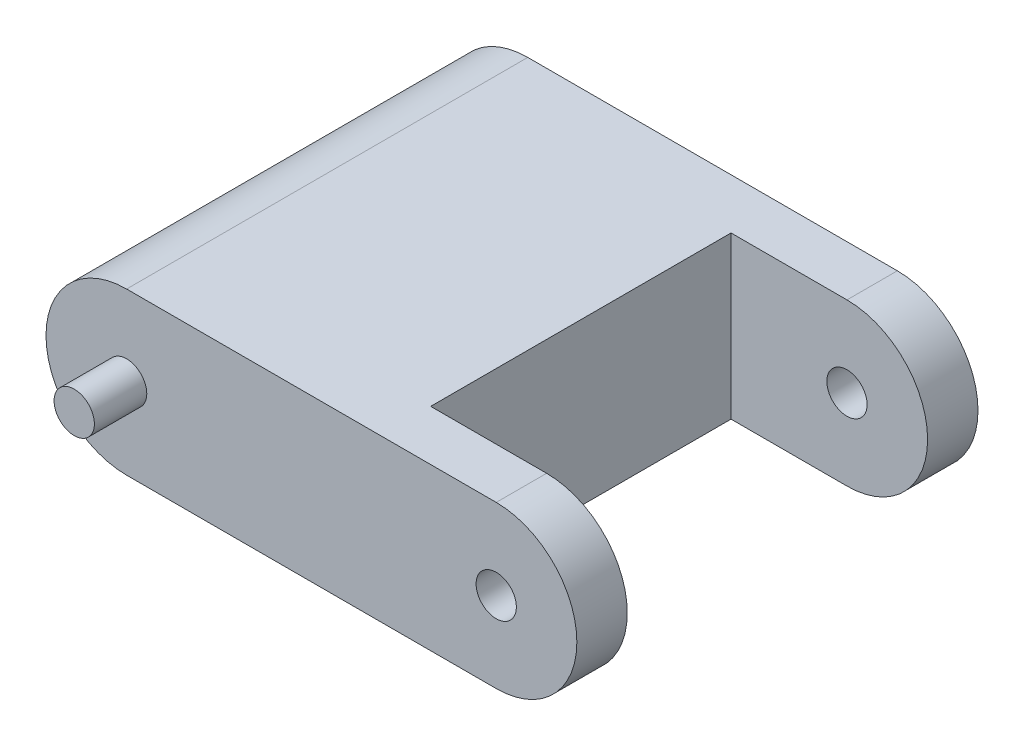
from build123d import *

# Parameters (mm, degrees)
SALIENTE_EXTRUIR1_DEPTH      = 199
CROQUIS6_R                   = 9.988
CORTAR_EXTRUIR3_DEPTH        = 240
SALIENTE_EXTRUIR3_DEPTH      = 26
SALIENTE_EXTRUIR3_DEPTH_BACK = 225
CROQUIS3_R                   = 10
CROQUIS12_W                  = 123.646893132
CROQUIS12_H                  = 149
CORTAR_EXTRUIR7_DEPTH        = 122


with BuildPart() as part:
    # Croquis2 → Saliente-Extruir1 (new body)
    with BuildSketch(Plane.XY):
        with BuildLine():
            Line((0, 40), (183.351967946, 40))
            ThreePointArc((183.351967946, 40), (223.351967946, 0), (183.351967946, -40))
            Line((183.351967946, -40), (0, -40))
            ThreePointArc((0, -40), (-40, 0), (0, 40))
        make_face()
    extrude(amount=SALIENTE_EXTRUIR1_DEPTH)

    # Croquis6 → Cortar-Extruir3 (cut)
    with BuildSketch(Plane(origin=(0, 0, 0), x_dir=(-1, 0, 0), z_dir=(0, 0, -1))):
        with Locations((-183.351967946, 0)):
            Circle(CROQUIS6_R)
    extrude(amount=-CORTAR_EXTRUIR3_DEPTH, mode=Mode.SUBTRACT)

    # Croquis3 → Saliente-Extruir3 (add, two sides: drawn at the far end of the back side and taken through both)
    with BuildSketch(Plane.XY.offset(199).offset(-SALIENTE_EXTRUIR3_DEPTH_BACK)):
        Circle(CROQUIS3_R)
    extrude(amount=SALIENTE_EXTRUIR3_DEPTH + SALIENTE_EXTRUIR3_DEPTH_BACK)

    # Croquis12 → Cortar-Extruir7 (cut)
    with BuildSketch(Plane(origin=(0, 40, 0), x_dir=(1, 0, 0), z_dir=(0, 1, 0))):
        with Locations((187.658688953, -99.5)):
            Rectangle(CROQUIS12_W, CROQUIS12_H)
    extrude(amount=-CORTAR_EXTRUIR7_DEPTH, mode=Mode.SUBTRACT)


solid = part.part
